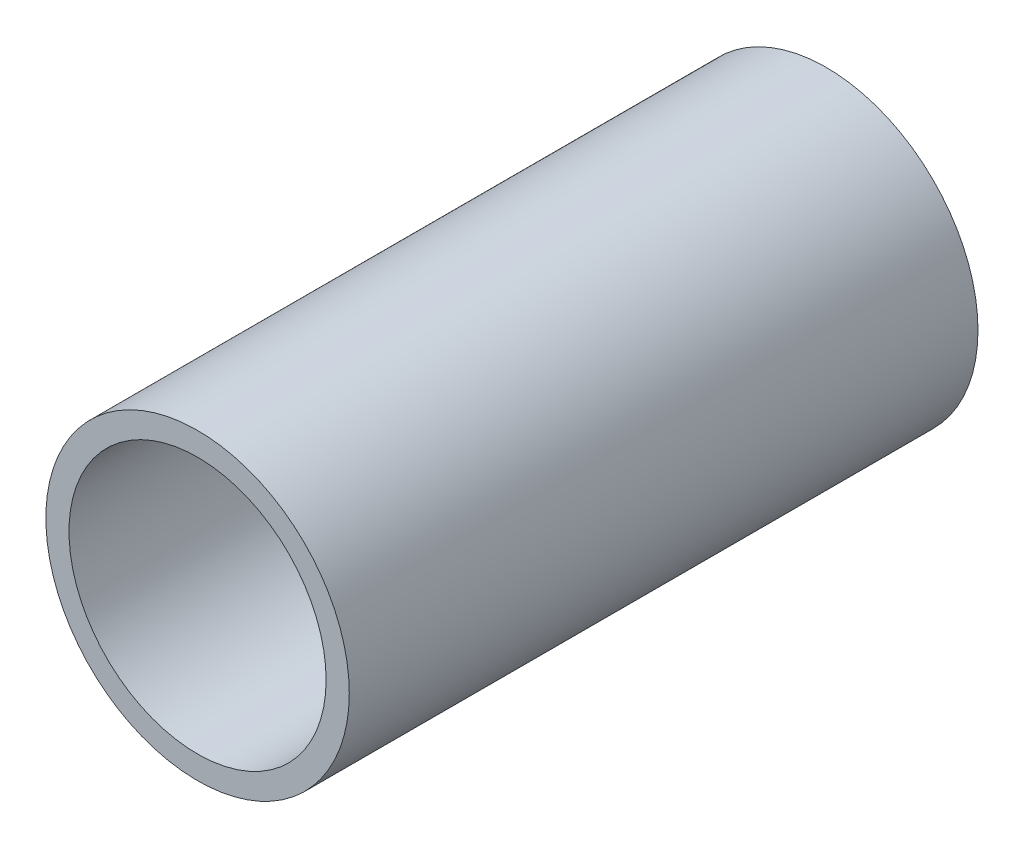
from build123d import *

# Parameters (mm, degrees)
CROQUIS2_R              = 24.13
CROQUIS2_R_2            = 20.447
SALIENTE_EXTRUIR1_DEPTH = 50


with BuildPart() as part:
    # Croquis2 → Saliente-Extruir1 (new, symmetric)
    with BuildSketch(Plane.XY):
        Circle(CROQUIS2_R)
        Circle(CROQUIS2_R_2, mode=Mode.SUBTRACT)
    extrude(amount=SALIENTE_EXTRUIR1_DEPTH, both=True)


solid = part.part
